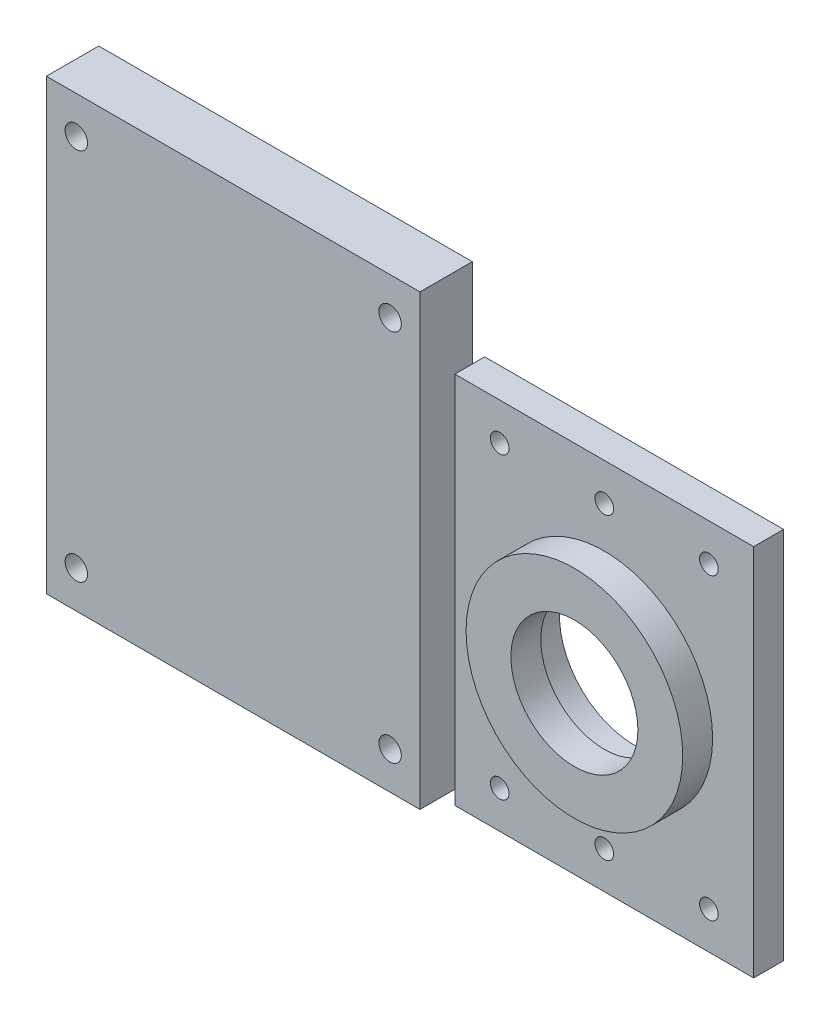
from build123d import *

# Parameters (mm, degrees)
SKETCH1_W           = 50
SKETCH1_H           = 40
SKETCH1_R           = 10
SKETCH1_R_2         = 1.25
BOSS_EXTRUDE1_DEPTH = 4
SKETCH2_R           = 14.5
SKETCH2_R_2         = 8.5
BOSS_EXTRUDE2_DEPTH = 4
SKETCH3_W           = 50
SKETCH3_H           = 60
SKETCH3_R           = 1.5
BOSS_EXTRUDE3_DEPTH = 7


with BuildPart() as part:
    # Sketch1 → Boss-Extrude1 (new body)
    with BuildSketch(Plane(origin=(0, 0, 0), x_dir=(0, 1, 0), z_dir=(0, 0, 1))):
        Rectangle(SKETCH1_W, SKETCH1_H)
        with Locations(Location((0, 0, 0), (0, 0, 270))):
            Circle(SKETCH1_R, mode=Mode.SUBTRACT)
        with Locations(Location((-20, 14, 0), (0, 0, 270))):
            Circle(SKETCH1_R_2, mode=Mode.SUBTRACT)
        with Locations(Location((-20, -14, 0), (0, 0, 270))):
            Circle(SKETCH1_R_2, mode=Mode.SUBTRACT)
        with Locations(Location((20, 14, 0), (0, 0, 270))):
            Circle(SKETCH1_R_2, mode=Mode.SUBTRACT)
        with Locations(Location((20, -14, 0), (0, 0, 270))):
            Circle(SKETCH1_R_2, mode=Mode.SUBTRACT)
        with Locations(Location((-20, 0, 0), (0, 0, 270))):
            Circle(SKETCH1_R_2, mode=Mode.SUBTRACT)
        with Locations(Location((20, 0, 0), (0, 0, 270))):
            Circle(SKETCH1_R_2, mode=Mode.SUBTRACT)
    extrude(amount=BOSS_EXTRUDE1_DEPTH)

    # Sketch2 → Boss-Extrude2 (add)
    with BuildSketch(Plane.XY.offset(4)):
        Circle(SKETCH2_R)
        Circle(SKETCH2_R_2, mode=Mode.SUBTRACT)
    extrude(amount=BOSS_EXTRUDE2_DEPTH)


with BuildPart() as body_2:
    # Sketch3 → Boss-Extrude3 (new body)
    with BuildSketch(Plane(origin=(0, 0, 0), x_dir=(1, 0, 0), z_dir=(0, 0, -1))):
        with Locations((-46.669401007, -5.199106425)):
            Rectangle(SKETCH3_W, SKETCH3_H)
        with Locations(Location((-67.669401007, 19.800893575, 0), (0, 0, 180))):
            Circle(SKETCH3_R, mode=Mode.SUBTRACT)
        with Locations((-25.669401007, 19.800893575)):
            Circle(SKETCH3_R, mode=Mode.SUBTRACT)
        with Locations(Location((-25.669401007, -30.199106425, 0), (0, 0, 180))):
            Circle(SKETCH3_R, mode=Mode.SUBTRACT)
        with Locations((-67.669401007, -30.199106425)):
            Circle(SKETCH3_R, mode=Mode.SUBTRACT)
    extrude(amount=-BOSS_EXTRUDE3_DEPTH)


solid = Compound([part.part, body_2.part])
